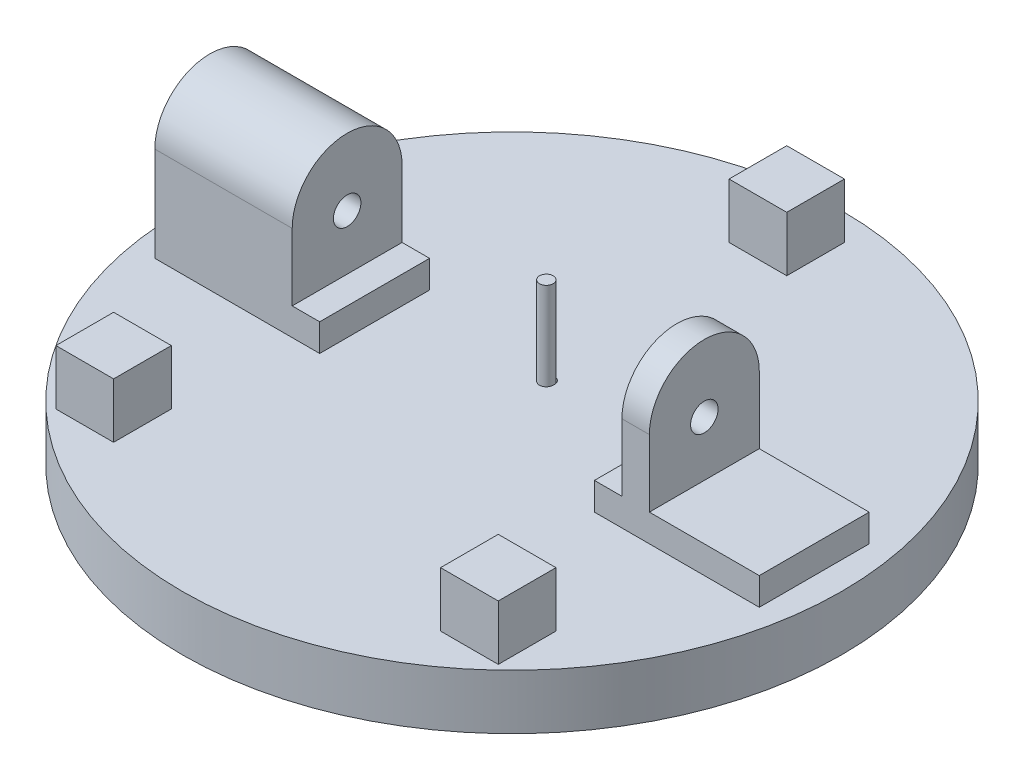
from build123d import *

# Parameters (mm, degrees)
SKETCH1_R                = 120
BOSS_EXTRUDE1_DEPTH      = 10
SKETCH2_W                = 60
SKETCH2_H                = 40
BOSS_EXTRUDE2_DEPTH      = 10
CUT_EXTRUDE1_DEPTH       = 171.880074906
CUT_EXTRUDE1_DEPTH_BACK  = 171.880074906
SKETCH3_R                = 2.5
SKETCH4_R                = 5
BOSS_EXTRUDE4_DEPTH      = 10
SKETCH5_R                = 15
BOSS_EXTRUDE5_DEPTH      = 40
CUT_EXTRUDE2_DEPTH       = 179.222286063
CUT_EXTRUDE2_DEPTH_BACK  = 179.222286063
SKETCH7_R                = 10
SKETCH8_W                = 21
SKETCH8_H                = 21
BOSS_EXTRUDE8_DEPTH      = 20
BOSS_EXTRUDE9_DEPTH      = 42
BOSS_EXTRUDE9_DEPTH_BACK = 35.076669
SKETCH9_R                = 2.5


with BuildPart() as part:
    # Sketch1 → Boss-Extrude1 (new, symmetric)
    with BuildSketch(Plane(origin=(0, 0, 0), x_dir=(1, 0, 0), z_dir=(0, 1, 0))):
        with Locations(Location((0, 0, 0), (0, 0, 270))):
            Circle(SKETCH1_R)
    extrude(amount=BOSS_EXTRUDE1_DEPTH, both=True)

    # Sketch2 → Boss-Extrude2 (add)
    with BuildSketch(Plane(origin=(0, 10, 0), x_dir=(1, 0, 0), z_dir=(0, 1, 0))):
        with Locations((-80, 0)):
            Rectangle(SKETCH2_W, SKETCH2_H)
        with Locations((80, 0)):
            Rectangle(SKETCH2_W, SKETCH2_H)
    extrude(amount=BOSS_EXTRUDE2_DEPTH)

    # Sketch3 → Cut-Extrude1 (cut, two sides: drawn at the far end of the back side and taken through both)
    with BuildSketch(Plane(origin=(0, 10, 0), x_dir=(1, 0, 0), z_dir=(0, 1, 0)).offset(-CUT_EXTRUDE1_DEPTH_BACK)):
        with Locations(Location((0, 13, 0), (0, 0, 270))):
            Circle(SKETCH3_R)
    extrude(amount=CUT_EXTRUDE1_DEPTH + CUT_EXTRUDE1_DEPTH_BACK, mode=Mode.SUBTRACT)

    # Sketch4 → Boss-Extrude4 (add)
    with BuildSketch(Plane(origin=(-60, 0, 0), x_dir=(0, 0, -1), z_dir=(1, 0, 0))):
        with BuildLine():
            ThreePointArc((-20, 44.435128818), (0, 64.435128818), (20, 44.435128818))
            Line((20, 44.435128818), (20, 20))
            Line((20, 20), (-20, 20))
            Line((-20, 20), (-20, 44.435128818))
        make_face()
        with Locations((0, 40)):
            Circle(SKETCH4_R, mode=Mode.SUBTRACT)
    boss_extrude4 = extrude(amount=-BOSS_EXTRUDE4_DEPTH)

    # Sketch5 → Boss-Extrude5 (add)
    with BuildSketch(Plane.ZY.offset(70)):
        with BuildLine():
            Line((-20, 20), (20, 20))
            Line((20, 20), (20, 44.435128818))
            ThreePointArc((20, 44.435128818), (0, 64.435128818), (-20, 44.435128818))
            Line((-20, 44.435128818), (-20, 20))
        make_face()
        with Locations((0, 40)):
            Circle(SKETCH5_R, mode=Mode.SUBTRACT)
    extrude(amount=BOSS_EXTRUDE5_DEPTH)

    # Mirror2: Boss-Extrude4 across plane
    add(boss_extrude4.mirror(Plane(origin=(0, 0, 0), x_dir=(0, 0, 1), z_dir=(1, 0, 0))))

    # Sketch7 → Cut-Extrude2 (cut, two sides: drawn at the far end of the back side and taken through both)
    with BuildSketch(Plane(origin=(0, 10, 0), x_dir=(1, 0, 0), z_dir=(0, 1, 0)).offset(-CUT_EXTRUDE2_DEPTH_BACK)):
        with Locations(Location((0, 100, 0), (0, 0, 270))):
            Circle(SKETCH7_R)
        with Locations(Location((-70, -75, 0), (0, 0, 270))):
            Circle(SKETCH7_R)
        with Locations(Location((70, -75, 0), (0, 0, 270))):
            Circle(SKETCH7_R)
    extrude(amount=CUT_EXTRUDE2_DEPTH + CUT_EXTRUDE2_DEPTH_BACK, mode=Mode.SUBTRACT)

    # Sketch8 → Boss-Extrude8 (add)
    with BuildSketch(Plane(origin=(0, 10, 0), x_dir=(1, 0, 0), z_dir=(0, 1, 0))):
        with Locations((-70, -75)):
            Rectangle(SKETCH8_W, SKETCH8_H)
        with Locations((0, 100)):
            Rectangle(SKETCH8_W, SKETCH8_H)
        with Locations((70, -75)):
            Rectangle(SKETCH8_W, SKETCH8_H)
    extrude(amount=BOSS_EXTRUDE8_DEPTH)

    # Sketch9 → Boss-Extrude9 (add, two sides: drawn at the far end of the back side and taken through both)
    with BuildSketch(Plane(origin=(0, 0, 0), x_dir=(1, 0, 0), z_dir=(0, 1, 0)).offset(-BOSS_EXTRUDE9_DEPTH_BACK)):
        with Locations(Location((0, 12.5, 0), (0, 0, 270))):
            Circle(SKETCH9_R)
    extrude(amount=BOSS_EXTRUDE9_DEPTH + BOSS_EXTRUDE9_DEPTH_BACK)


solid = part.part
